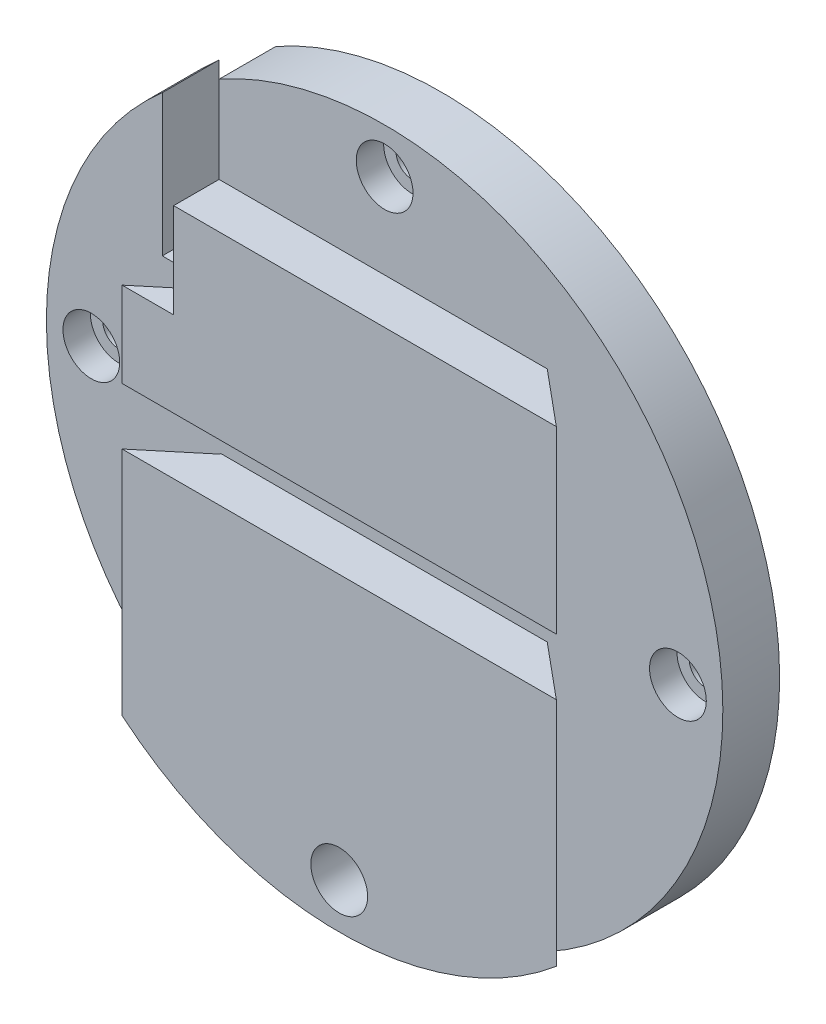
from build123d import *

# Parameters (mm, degrees)
SKETCH1_R                      = 35.75
SKETCH1_R_2                    = 1.7
BOSS_EXTRUDE1_DEPTH            = 10.8
CUT_EXTRUDE1_START             = -7.7
SKETCH2_R                      = 3
SKETCH2_R_2                    = 1.7
CUT_EXTRUDE1_DEPTH             = 7.7
SKETCH3_W                      = 6
SKETCH3_H                      = 10
CUT_EXTRUDE2_DEPTH             = 52.698791088
CUT_EXTRUDE3_DEPTH             = 52.698791088
CUT_EXTRUDE3_DIRECTION_2_REACH = 53.699
BOSS_EXTRUDE2_DEPTH            = 7.7
CUT_EXTRUDE4_DEPTH             = 66.040487391
CUT_EXTRUDE4_DEPTH_BACK        = 66.040487391
SKETCH6_W                      = 4.8
SKETCH6_H                      = 17.274998913
CUT_EXTRUDE5_DEPTH             = 66.040487391
CUT_EXTRUDE5_DEPTH_BACK        = 66.040487391
SKETCH8_W                      = 6
SKETCH8_H                      = 23.025515334
CUT_EXTRUDE6_DEPTH             = 10


with BuildPart() as part:
    # Sketch1 → Boss-Extrude1 (new body)
    with BuildSketch(Plane.XY):
        with Locations(Location((0, 0, 0), (0, 0, 180))):
            Circle(SKETCH1_R)
        with Locations(Location((0, 31, 0), (0, 0, 180))):
            Circle(SKETCH1_R_2, mode=Mode.SUBTRACT)
        with Locations(Location((31, 0, 0), (0, 0, 180))):
            Circle(SKETCH1_R_2, mode=Mode.SUBTRACT)
        with Locations(Location((0, -31, 0), (0, 0, 180))):
            Circle(SKETCH1_R_2, mode=Mode.SUBTRACT)
        with Locations(Location((-31, 0, 0), (0, 0, 180))):
            Circle(SKETCH1_R_2, mode=Mode.SUBTRACT)
    extrude(amount=BOSS_EXTRUDE1_DEPTH)

    # Sketch2 → Cut-Extrude1 (cut)
    # profile 1 of 4: a face of its own
    with BuildSketch(Plane.XY.offset(10.8).offset(CUT_EXTRUDE1_START)):
        with Locations((-31, 0)):
            Circle(SKETCH2_R)
        with Locations(Location((-31, 0, 0), (0, 0, 180))):
            Circle(SKETCH2_R_2, mode=Mode.SUBTRACT)
    # profile 2 of 4: a face of its own
    with BuildSketch(Plane.XY.offset(10.8).offset(CUT_EXTRUDE1_START)):
        with Locations((31, 0)):
            Circle(SKETCH2_R)
        with Locations(Location((31, 0, 0), (0, 0, 180))):
            Circle(SKETCH2_R_2, mode=Mode.SUBTRACT)
    # profile 3 of 4: a face of its own
    with BuildSketch(Plane.XY.offset(10.8).offset(CUT_EXTRUDE1_START)):
        with Locations((0, -31)):
            Circle(SKETCH2_R)
        with Locations(Location((0, -31, 0), (0, 0, 180))):
            Circle(SKETCH2_R_2, mode=Mode.SUBTRACT)
    # profile 4 of 4: a face of its own
    with BuildSketch(Plane.XY.offset(10.8).offset(CUT_EXTRUDE1_START)):
        with Locations((0, 31)):
            Circle(SKETCH2_R)
    extrude(amount=CUT_EXTRUDE1_DEPTH, mode=Mode.SUBTRACT)

    # Sketch3 → Cut-Extrude2 (cut, through all)
    with BuildSketch(Plane.XY.offset(10.8)):
        with Locations((-20.5, 17)):
            Rectangle(SKETCH3_W, SKETCH3_H)
    extrude(amount=-CUT_EXTRUDE2_DEPTH, mode=Mode.SUBTRACT)

    # Sketch4 → Cut-Extrude3 (cut)
    with BuildSketch(Plane(origin=(0, 0, 0), x_dir=(1, 0, 0), z_dir=(0, 1, 0))):
        Polygon((35.75, -6), (17.3, -6), (23.06, -10.8), (35.75, -10.8), align=None)
        Polygon((23.06, -10.8), (22.947590013, -10.8), (17.187590013, -6), (17.3, -6), align=None)
        Polygon((-23.26, -10.8), (-17.5, -6), (-35.75, -6), (-35.75, -10.8), align=None)
        Polygon((-23.06, -10.8), (-17.3, -6), (-17.5, -6), (-23.26, -10.8), align=None)
        Polygon((-17.3, -6.093674989), (-17.3, -6), (-23.06, -10.8), (-22.947590013, -10.8), align=None)
    extrude(amount=-CUT_EXTRUDE3_DEPTH, mode=Mode.SUBTRACT)

    # Cut-Extrude3 direction 2: up to this face of the body (flat: up to its plane)
    cut_extrude3_direction_2_end = Plane(part.part.faces().sort_by_distance((-20.5, 22, 5.4))[0])
    # Sketch4 → Cut-Extrude3 direction 2 (cut, up to the picked face)
    with BuildSketch(Plane(origin=(0, 0, 0), x_dir=(1, 0, 0), z_dir=(0, 1, 0)), mode=Mode.PRIVATE) as cut_extrude3_direction_2_sk1:
        Polygon((35.75, -6), (17.3, -6), (23.06, -10.8), (35.75, -10.8), align=None)
    cut_extrude3_direction_2_tool1 = split(extrude(cut_extrude3_direction_2_sk1.sketch, amount=CUT_EXTRUDE3_DIRECTION_2_REACH, mode=Mode.PRIVATE), bisect_by=cut_extrude3_direction_2_end, keep=Keep.BOTH, mode=Mode.PRIVATE)
    # Sketch4 → Cut-Extrude3 direction 2 (cut, up to the picked face)
    with BuildSketch(Plane(origin=(0, 0, 0), x_dir=(1, 0, 0), z_dir=(0, 1, 0)), mode=Mode.PRIVATE) as cut_extrude3_direction_2_sk2:
        Polygon((23.06, -10.8), (22.947590013, -10.8), (17.187590013, -6), (17.3, -6), align=None)
    cut_extrude3_direction_2_tool2 = split(extrude(cut_extrude3_direction_2_sk2.sketch, amount=CUT_EXTRUDE3_DIRECTION_2_REACH, mode=Mode.PRIVATE), bisect_by=cut_extrude3_direction_2_end, keep=Keep.BOTH, mode=Mode.PRIVATE)
    # Sketch4 → Cut-Extrude3 direction 2 (cut, up to the picked face)
    with BuildSketch(Plane(origin=(0, 0, 0), x_dir=(1, 0, 0), z_dir=(0, 1, 0)), mode=Mode.PRIVATE) as cut_extrude3_direction_2_sk3:
        Polygon((-23.26, -10.8), (-17.5, -6), (-35.75, -6), (-35.75, -10.8), align=None)
    cut_extrude3_direction_2_tool3 = split(extrude(cut_extrude3_direction_2_sk3.sketch, amount=CUT_EXTRUDE3_DIRECTION_2_REACH, mode=Mode.PRIVATE), bisect_by=cut_extrude3_direction_2_end, keep=Keep.BOTH, mode=Mode.PRIVATE)
    # Sketch4 → Cut-Extrude3 direction 2 (cut, up to the picked face)
    with BuildSketch(Plane(origin=(0, 0, 0), x_dir=(1, 0, 0), z_dir=(0, 1, 0)), mode=Mode.PRIVATE) as cut_extrude3_direction_2_sk4:
        Polygon((-23.06, -10.8), (-17.3, -6), (-17.5, -6), (-23.26, -10.8), align=None)
    cut_extrude3_direction_2_tool4 = split(extrude(cut_extrude3_direction_2_sk4.sketch, amount=CUT_EXTRUDE3_DIRECTION_2_REACH, mode=Mode.PRIVATE), bisect_by=cut_extrude3_direction_2_end, keep=Keep.BOTH, mode=Mode.PRIVATE)
    # Sketch4 → Cut-Extrude3 direction 2 (cut, up to the picked face)
    with BuildSketch(Plane(origin=(0, 0, 0), x_dir=(1, 0, 0), z_dir=(0, 1, 0)), mode=Mode.PRIVATE) as cut_extrude3_direction_2_sk5:
        Polygon((-17.3, -6.093674989), (-17.3, -6), (-23.06, -10.8), (-22.947590013, -10.8), align=None)
    cut_extrude3_direction_2_tool5 = split(extrude(cut_extrude3_direction_2_sk5.sketch, amount=CUT_EXTRUDE3_DIRECTION_2_REACH, mode=Mode.PRIVATE), bisect_by=cut_extrude3_direction_2_end, keep=Keep.BOTH, mode=Mode.PRIVATE)
    add(cut_extrude3_direction_2_tool1.solids().sort_by(Axis((27.876214, 0, 8.252023), (0, 1, 0)))[0], mode=Mode.SUBTRACT)
    add(cut_extrude3_direction_2_tool2.solids().sort_by(Axis((20.123795, 0, 8.4), (0, 1, 0)))[0], mode=Mode.SUBTRACT)
    add(cut_extrude3_direction_2_tool3.solids().sort_by(Axis((-27.975059, 0, 8.250098), (0, 1, 0)))[0], mode=Mode.SUBTRACT)
    add(cut_extrude3_direction_2_tool4.solids().sort_by(Axis((-20.28, 0, 8.4), (0, 1, 0)))[0], mode=Mode.SUBTRACT)
    add(cut_extrude3_direction_2_tool5.solids().sort_by(Axis((-20.15199, 0, 8.423342), (0, 1, 0)))[0], mode=Mode.SUBTRACT)

    # Sketch5 → Boss-Extrude2 (add)
    with BuildSketch(Plane.ZY.offset(17.5)):
        Polygon((6.260341656, 22), (6.166666667, 22), (6, 22), (6, 12), (6.260341656, 12), align=None)
    extrude(amount=-BOSS_EXTRUDE2_DEPTH)

    # Sketch6 → Cut-Extrude4 (cut, two sides: drawn at the far end of the back side and taken through both)
    with BuildSketch(Plane.ZY.offset(17.5).offset(-CUT_EXTRUDE4_DEPTH_BACK)):
        with Locations((8.4, 30.637499457)):
            Rectangle(SKETCH6_W, SKETCH6_H)
    extrude(amount=CUT_EXTRUDE4_DEPTH + CUT_EXTRUDE4_DEPTH_BACK, mode=Mode.SUBTRACT)

    # Sketch7 → Cut-Extrude5 (cut, two sides: drawn at the far end of the back side and taken through both)
    with BuildSketch(Plane.ZY.offset(17.5).offset(-CUT_EXTRUDE5_DEPTH_BACK)):
        Polygon((6, -3), (6, 0), (6, 3), (10.8, 3), (10.8, -3), align=None)
    extrude(amount=CUT_EXTRUDE5_DEPTH + CUT_EXTRUDE5_DEPTH_BACK, mode=Mode.SUBTRACT)

    # Sketch8 → Cut-Extrude6 (cut)
    with BuildSketch(Plane(origin=(0, 0, 0), x_dir=(-1, 0, 0), z_dir=(0, 0, -1))):
        with Locations((20.5, 23.512757667)):
            Rectangle(SKETCH8_W, SKETCH8_H)
    extrude(amount=-CUT_EXTRUDE6_DEPTH, mode=Mode.SUBTRACT)


solid = part.part
